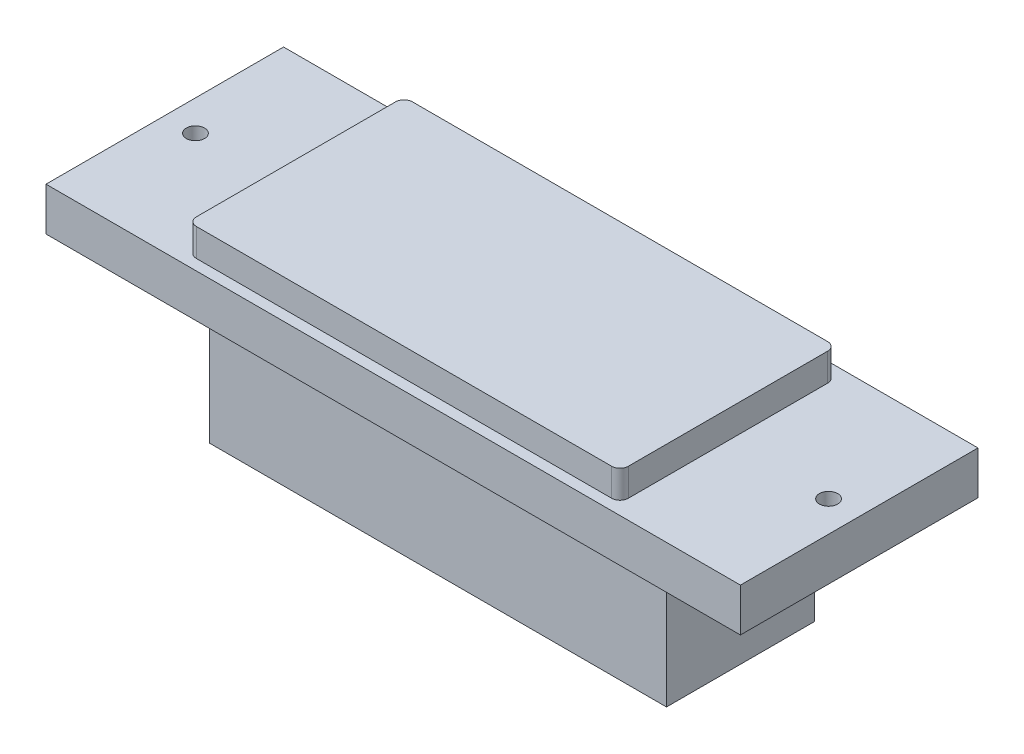
from build123d import *

# Parameters (mm, degrees)
SKETCH1_W             = 66.04
SKETCH1_H             = 33.02
BOSS_EXTRUDE1_DEPTH   = 4.2418
FILLET1_R             = 1.27
SKETCH2_W             = 106.172
SKETCH2_H             = 36.322
BOSS_EXTRUDE2_DEPTH   = 6.604
F_3_CLEARANCE_HOLE1_D = 2.794
SKETCH6_W             = 69.85
SKETCH6_H             = 22.606
BOSS_EXTRUDE3_DEPTH   = 22.0472


with BuildPart() as part:
    # Sketch1 → Boss-Extrude1 (new body)
    with BuildSketch(Plane(origin=(0, 0, 0), x_dir=(1, 0, 0), z_dir=(0, 1, 0))):
        Rectangle(SKETCH1_W, SKETCH1_H)
    extrude(amount=BOSS_EXTRUDE1_DEPTH)

    # Fillet1
    fillet1_edges = [part.edges().sort_by_distance(p)[0] for p in [
        (33.02, 2.1209, 16.51),
        (-33.02, 2.1209, 16.51),
        (-33.02, 2.1209, -16.51),
        (33.02, 2.1209, -16.51),
    ]]
    fillet(fillet1_edges, radius=FILLET1_R)

    # Sketch2 → Boss-Extrude2 (add)
    with BuildSketch(Plane.XZ):
        Rectangle(SKETCH2_W, SKETCH2_H)
    extrude(amount=BOSS_EXTRUDE2_DEPTH)

    # #3 Clearance Hole1 (through all)
    with Locations(Plane(origin=(0, 0, 0), x_dir=(1, 0, 0), z_dir=(0, 1, 0))):
        with Locations((-48.3997, 0), (48.3997, 0)):
            Hole(F_3_CLEARANCE_HOLE1_D / 2)

    # Sketch6 → Boss-Extrude3 (add)
    with BuildSketch(Plane.XZ.offset(6.604)):
        Rectangle(SKETCH6_W, SKETCH6_H)
    extrude(amount=BOSS_EXTRUDE3_DEPTH)


solid = part.part
